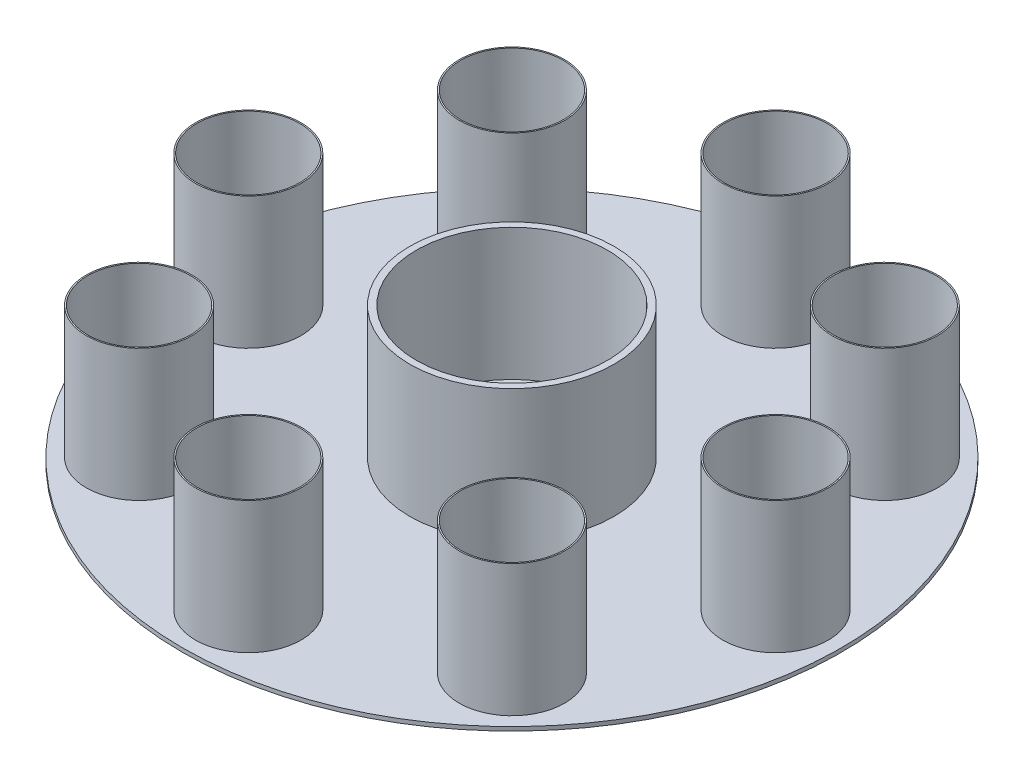
from build123d import *

# Parameters (mm, degrees)
SKETCH1_R           = 250
SKETCH1_R_2         = 39
BOSS_EXTRUDE1_DEPTH = 3
SKETCH2_R           = 40
SKETCH2_R_2         = 39
BOSS_EXTRUDE2_DEPTH = 100
SKETCH3_R           = 77.5
SKETCH3_R_2         = 72.5
BOSS_EXTRUDE3_DEPTH = 100


with BuildPart() as part:
    # Sketch1 → Boss-Extrude1 (new body)
    with BuildSketch(Plane(origin=(0, 0, 0), x_dir=(1, 0, 0), z_dir=(0, 1, 0))):
        with Locations(Location((0, 0, 0), (0, 0, 270))):
            Circle(SKETCH1_R)
        with Locations(Location((141.421356237, 141.421356237, 0), (0, 0, 270))):
            Circle(SKETCH1_R_2, mode=Mode.SUBTRACT)
        with Locations(Location((-141.421356237, 141.421356237, 0), (0, 0, 90))):
            Circle(SKETCH1_R_2, mode=Mode.SUBTRACT)
        with Locations(Location((-141.421356237, -141.421356237, 0), (0, 0, 270))):
            Circle(SKETCH1_R_2, mode=Mode.SUBTRACT)
        with Locations(Location((141.421356237, -141.421356237, 0), (0, 0, 90))):
            Circle(SKETCH1_R_2, mode=Mode.SUBTRACT)
        with Locations(Location((0, 200, 0), (0, 0, 270))):
            Circle(SKETCH1_R_2, mode=Mode.SUBTRACT)
        with Locations(Location((200, 0, 0), (0, 0, 90))):
            Circle(SKETCH1_R_2, mode=Mode.SUBTRACT)
        with Locations(Location((0, -200, 0), (0, 0, 270))):
            Circle(SKETCH1_R_2, mode=Mode.SUBTRACT)
        with Locations(Location((-200, 0, 0), (0, 0, 270))):
            Circle(SKETCH1_R_2, mode=Mode.SUBTRACT)
    extrude(amount=BOSS_EXTRUDE1_DEPTH)

    # Sketch2 → Boss-Extrude2 (add)
    # profile 1 of 8: a face of its own
    with BuildSketch(Plane(origin=(0, 3, 0), x_dir=(1, 0, 0), z_dir=(0, 1, 0))):
        with Locations(Location((0, 200, 0), (0, 0, 270))):
            Circle(SKETCH2_R)
        with Locations(Location((0, 200, 0), (0, 0, 270))):
            Circle(SKETCH2_R_2, mode=Mode.SUBTRACT)
    # profile 2 of 8: a face of its own
    with BuildSketch(Plane(origin=(0, 3, 0), x_dir=(1, 0, 0), z_dir=(0, 1, 0))):
        with Locations(Location((141.421356237, 141.421356237, 0), (0, 0, 270))):
            Circle(SKETCH2_R)
        with Locations(Location((141.421356237, 141.421356237, 0), (0, 0, 270))):
            Circle(SKETCH2_R_2, mode=Mode.SUBTRACT)
    # profile 3 of 8: a face of its own
    with BuildSketch(Plane(origin=(0, 3, 0), x_dir=(1, 0, 0), z_dir=(0, 1, 0))):
        with Locations(Location((200, 0, 0), (0, 0, 270))):
            Circle(SKETCH2_R)
        with Locations(Location((200, 0, 0), (0, 0, 90))):
            Circle(SKETCH2_R_2, mode=Mode.SUBTRACT)
    # profile 4 of 8: a face of its own
    with BuildSketch(Plane(origin=(0, 3, 0), x_dir=(1, 0, 0), z_dir=(0, 1, 0))):
        with Locations(Location((141.421356237, -141.421356237, 0), (0, 0, 270))):
            Circle(SKETCH2_R)
        with Locations(Location((141.421356237, -141.421356237, 0), (0, 0, 90))):
            Circle(SKETCH2_R_2, mode=Mode.SUBTRACT)
    # profile 5 of 8: a face of its own
    with BuildSketch(Plane(origin=(0, 3, 0), x_dir=(1, 0, 0), z_dir=(0, 1, 0))):
        with Locations(Location((0, -200, 0), (0, 0, 270))):
            Circle(SKETCH2_R)
        with Locations(Location((0, -200, 0), (0, 0, 270))):
            Circle(SKETCH2_R_2, mode=Mode.SUBTRACT)
    # profile 6 of 8: a face of its own
    with BuildSketch(Plane(origin=(0, 3, 0), x_dir=(1, 0, 0), z_dir=(0, 1, 0))):
        with Locations(Location((-141.421356237, -141.421356237, 0), (0, 0, 270))):
            Circle(SKETCH2_R)
        with Locations(Location((-141.421356237, -141.421356237, 0), (0, 0, 270))):
            Circle(SKETCH2_R_2, mode=Mode.SUBTRACT)
    # profile 7 of 8: a face of its own
    with BuildSketch(Plane(origin=(0, 3, 0), x_dir=(1, 0, 0), z_dir=(0, 1, 0))):
        with Locations(Location((-200, 0, 0), (0, 0, 270))):
            Circle(SKETCH2_R)
        with Locations(Location((-200, 0, 0), (0, 0, 270))):
            Circle(SKETCH2_R_2, mode=Mode.SUBTRACT)
    # profile 8 of 8: a face of its own
    with BuildSketch(Plane(origin=(0, 3, 0), x_dir=(1, 0, 0), z_dir=(0, 1, 0))):
        with Locations(Location((-141.421356237, 141.421356237, 0), (0, 0, 270))):
            Circle(SKETCH2_R)
        with Locations(Location((-141.421356237, 141.421356237, 0), (0, 0, 90))):
            Circle(SKETCH2_R_2, mode=Mode.SUBTRACT)
    extrude(amount=BOSS_EXTRUDE2_DEPTH)

    # Sketch3 → Boss-Extrude3 (add)
    with BuildSketch(Plane(origin=(0, 3, 0), x_dir=(1, 0, 0), z_dir=(0, 1, 0))):
        with Locations(Location((0, 0, 0), (0, 0, 270))):
            Circle(SKETCH3_R)
        with Locations(Location((0, 0, 0), (0, 0, 270))):
            Circle(SKETCH3_R_2, mode=Mode.SUBTRACT)
    extrude(amount=BOSS_EXTRUDE3_DEPTH)


solid = part.part
